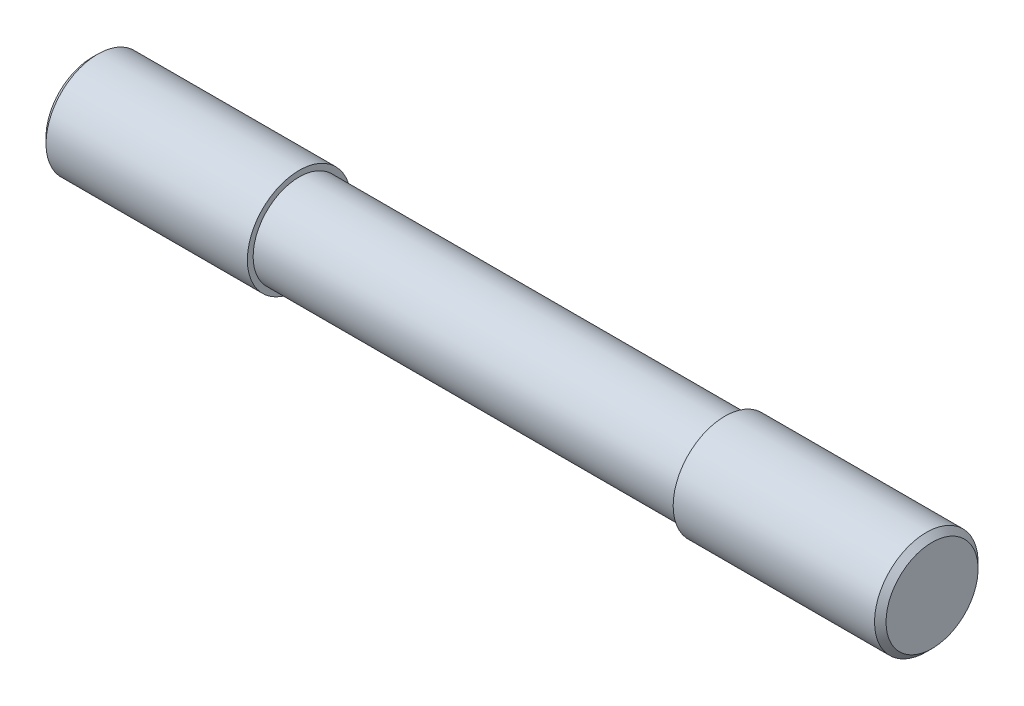
from build123d import *

# Parameters (mm, degrees)
CHAMFER1_SIZE = 2.5


with BuildPart() as part:
    # Sketch1 → Revolve1 (revolve)
    with BuildSketch(Plane(origin=(0, 0, 0), x_dir=(1, 0, 0), z_dir=(0, 1, 0)), mode=Mode.PRIVATE) as revolve1_sk:
        Polygon((365, 0), (365, 22.5), (275, 22.5), (275, 20), (90, 20), (90, 22.5), (0, 22.5), (0, 0), align=None)
    revolve(revolve1_sk.sketch.rotate(Axis((-60.584183673, 0, 0), (1, 0, 0)), 180), axis=Axis((-60.584183673, 0, 0), (1, 0, 0)))

    # Chamfer1
    chamfer1_edges = [part.edges().sort_by_distance(p)[0] for p in [
        (0, 0, -22.5),
        (365, 0, -22.5),
    ]]
    chamfer(chamfer1_edges, length=CHAMFER1_SIZE)


solid = part.part
